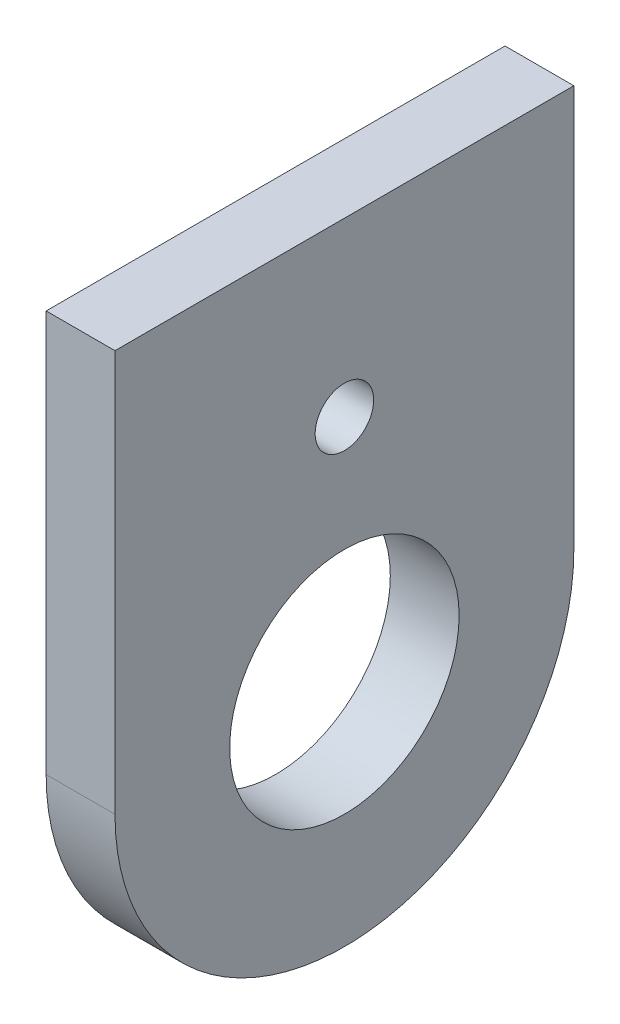
from build123d import *

# Parameters (mm, degrees)
SKETCH_1_R          = 20
EXTRUDE_1_DEPTH     = 12
HOLE_WIZARD_M12_1_D = 10.2


with BuildPart() as part:
    # 草图1 → 凸台-拉伸1 (new body)
    with BuildSketch(Plane(origin=(0, 0, 0), x_dir=(0, 0, -1), z_dir=(1, 0, 0))):
        with BuildLine():
            Line((-40, 0), (-40, 70))
            Line((-40, 70), (40, 70))
            Line((40, 70), (40, 0))
            ThreePointArc((40, 0), (0, -40), (-40, 0))
        make_face()
        Circle(SKETCH_1_R, mode=Mode.SUBTRACT)
    extrude(amount=EXTRUDE_1_DEPTH)

    # M12 螺纹孔1 (through all)
    with Locations(Plane(origin=(12, 0, 0), x_dir=(0, 0, -1), z_dir=(1, 0, 0))):
        with Locations((0, 40)):
            Hole(HOLE_WIZARD_M12_1_D / 2)


solid = part.part
